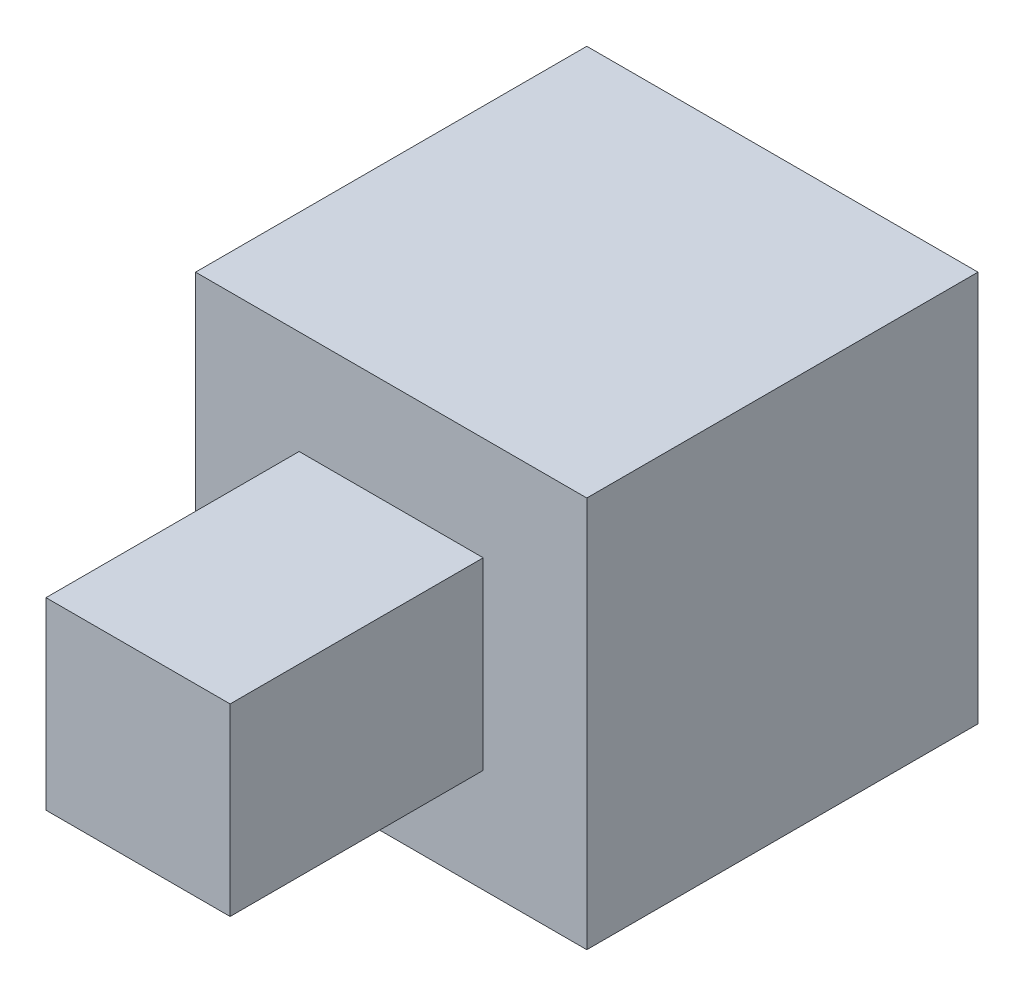
from build123d import *

# Parameters (mm, degrees)
SKETCH1_W           = 8.5
SKETCH1_H           = 8.5
BOSS_EXTRUDE1_DEPTH = 8.5
SKETCH2_W           = 4
SKETCH2_H           = 4
BOSS_EXTRUDE2_DEPTH = 5.5


with BuildPart() as part:
    # Sketch1 → Boss-Extrude1 (new body)
    with BuildSketch(Plane.XY):
        Rectangle(SKETCH1_W, SKETCH1_H)
    extrude(amount=BOSS_EXTRUDE1_DEPTH)

    # Sketch2 → Boss-Extrude2 (add)
    with BuildSketch(Plane.XY.offset(8.5)):
        Rectangle(SKETCH2_W, SKETCH2_H)
    extrude(amount=BOSS_EXTRUDE2_DEPTH)


solid = part.part
